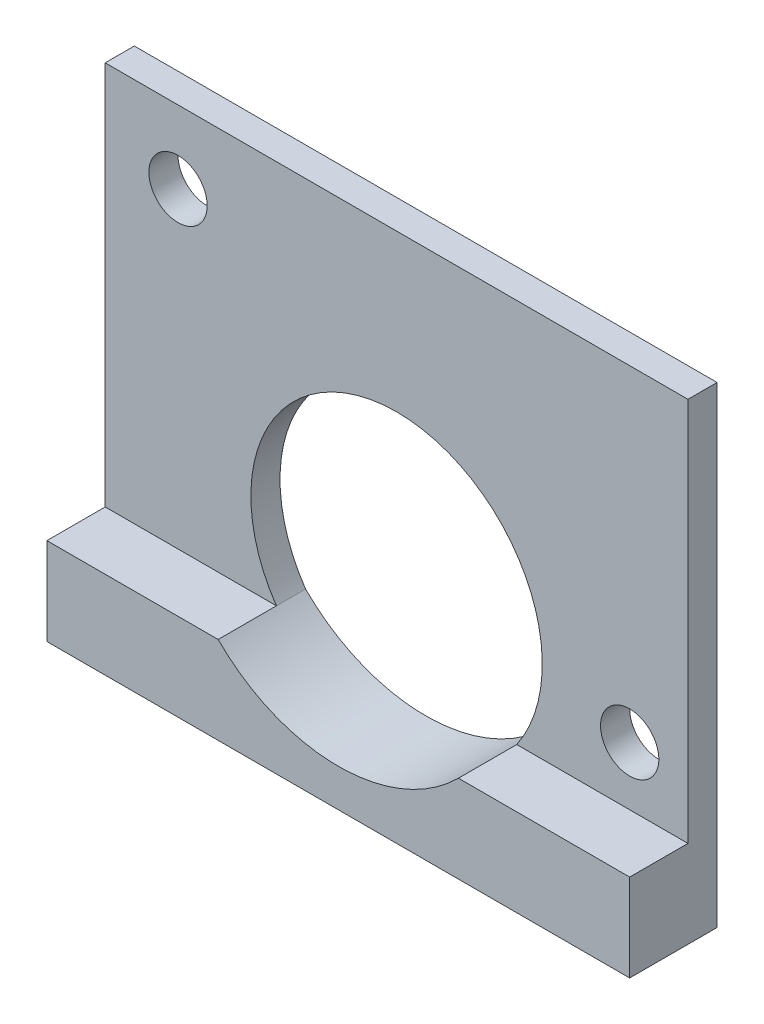
from build123d import *

# Parameters (mm, degrees)
CROQUIS1_R              = 1.628014373
SALIENTE_EXTRUIR1_DEPTH = 4
SALIENTE_EXTRUIR2_DEPTH = 9
CROQUIS3_R              = 1.5
CORTAR_EXTRUIR1_DEPTH   = 4
SALIENTE_EXTRUIR3_DEPTH = 7
CORTAR_EXTRUIR2_DEPTH   = 4.8
CROQUIS10_R             = 1
CORTAR_EXTRUIR3_DEPTH   = 4
SALIENTE_EXTRUIR4_START = 1
CROQUIS11_R             = 1
CROQUIS11_W             = 5.6
CROQUIS11_H             = 2.5
SALIENTE_EXTRUIR4_DEPTH = 1
CROQUIS12_W             = 27.503266124
CROQUIS12_H             = 20
CORTAR_EXTRUIR4_DEPTH   = 13
CROQUIS13_W             = 5.6
CROQUIS13_H             = 2.5
SALIENTE_EXTRUIR5_DEPTH = 1
SALIENTE_EXTRUIR6_DEPTH = 3
CROQUIS15_W             = 3
CROQUIS15_H             = 7
CORTAR_EXTRUIR5_DEPTH   = 3


with BuildPart() as part:
    # Croquis1 → Saliente-Extruir1 (new body)
    with BuildSketch(Plane.XY):
        with BuildLine():
            Line((-79.034482165, 42.285614206), (-79.034482165, 34.285614206))
            Line((-79.034482165, 34.285614206), (-85.534482165, 34.285614206))
            Line((-85.534482165, 34.285614206), (-85.534482165, 43.91362858))
            ThreePointArc((-85.534482165, 43.91362858), (-89.034482165, 47.41362858), (-92.534482165, 43.91362858))
            Line((-92.534482165, 43.91362858), (-92.534482165, 34.285614206))
            Line((-92.534482165, 34.285614206), (-99.034482165, 34.285614206))
            Line((-99.034482165, 34.285614206), (-99.034482165, 42.285614206))
            Line((-99.034482165, 42.285614206), (-99.034482165, 54.285614206))
            Line((-99.034482165, 54.285614206), (-79.034482165, 54.285614206))
            Line((-79.034482165, 54.285614206), (-79.034482165, 42.285614206))
        make_face()
        with Locations((-96.034482165, 38.285614206)):
            Circle(CROQUIS1_R, mode=Mode.SUBTRACT)
        with Locations((-82.034482165, 38.285614206)):
            Circle(CROQUIS1_R, mode=Mode.SUBTRACT)
    extrude(amount=SALIENTE_EXTRUIR1_DEPTH)

    # Croquis2 → Saliente-Extruir2 (add)
    with BuildSketch(Plane(origin=(0, 0, 0), x_dir=(-1, 0, 0), z_dir=(0, 0, -1))):
        with BuildLine():
            Line((79.034482165, 41.085614206), (83.629638531, 41.085614206))
            ThreePointArc((83.629638531, 41.085614206), (89.034482165, 50.01362858), (94.439325799, 41.085614206))
            Line((94.439325799, 41.085614206), (99.034482165, 41.085614206))
            Line((99.034482165, 41.085614206), (99.034482165, 54.285614206))
            Line((99.034482165, 54.285614206), (79.034482165, 54.285614206))
            Line((79.034482165, 54.285614206), (79.034482165, 41.085614206))
        make_face()
    extrude(amount=SALIENTE_EXTRUIR2_DEPTH)

    # Croquis3 → Cortar-Extruir1 (cut)
    with BuildSketch(Plane(origin=(0, 54.285614206, 0), x_dir=(1, 0, 0), z_dir=(0, 1, 0))):
        with Locations(Location((-90.034482165, 7, 0), (0, 0, 270))):
            Circle(CROQUIS3_R)
        with BuildLine():
            Line((-79.034482165, 8.118033989), (-79.034482165, 5.881966011))
            ThreePointArc((-79.034482165, 5.881966011), (-81.534482165, 7), (-79.034482165, 8.118033989))
        make_face()
    extrude(amount=-CORTAR_EXTRUIR1_DEPTH, mode=Mode.SUBTRACT)

    # Croquis4 → Saliente-Extruir3 (add)
    with BuildSketch(Plane(origin=(0, 54.285614206, 0), x_dir=(1, 0, 0), z_dir=(0, 1, 0))):
        with BuildLine():
            Line((-76.034482165, 1), (-76.034482165, 9))
            Line((-76.034482165, 9), (-79.034482165, 9))
            Line((-79.034482165, 9), (-79.034482165, 8.118033989))
            ThreePointArc((-79.034482165, 8.118033989), (-78.534482165, 7), (-79.034482165, 5.881966011))
            Line((-79.034482165, 5.881966011), (-79.034482165, -4))
            Line((-79.034482165, -4), (-76.034482165, 1))
        make_face()
    extrude(amount=-SALIENTE_EXTRUIR3_DEPTH)

    # Croquis5 → Cortar-Extruir2 (cut)
    with BuildSketch(Plane(origin=(0, 0, -9), x_dir=(-1, 0, 0), z_dir=(0, 0, -1))):
        Polygon((90.034482165, 50.285614206), (92.834482165, 50.285614206), (92.834482165, 52.785614206), (87.234482165, 52.785614206), (87.234482165, 50.285614206), align=None)
        Polygon((80.034482165, 50.285614206), (82.834482165, 50.285614206), (82.834482165, 52.785614206), (77.234482165, 52.785614206), (77.234482165, 50.285614206), align=None)
    extrude(amount=-CORTAR_EXTRUIR2_DEPTH, mode=Mode.SUBTRACT)

    # Croquis10 → Cortar-Extruir3 (cut)
    with BuildSketch(Plane(origin=(0, 0, -9), x_dir=(-1, 0, 0), z_dir=(0, 0, -1))):
        with Locations((96.534482165, 51.785614206)):
            Circle(CROQUIS10_R)
        with Locations((81.034482165, 43.085614206)):
            Circle(CROQUIS10_R)
    extrude(amount=-CORTAR_EXTRUIR3_DEPTH, mode=Mode.SUBTRACT)

    # Croquis11 → Saliente-Extruir4 (add)
    with BuildSketch(Plane(origin=(0, 0, -9), x_dir=(-1, 0, 0), z_dir=(0, 0, -1)).offset(SALIENTE_EXTRUIR4_START)):
        with BuildLine():
            Line((94.439325799, 41.085614206), (99.034482165, 41.085614206))
            Line((99.034482165, 41.085614206), (99.034482165, 54.285614206))
            Line((99.034482165, 54.285614206), (76.034482165, 54.285614206))
            Line((76.034482165, 54.285614206), (76.034482165, 47.285614206))
            Line((76.034482165, 47.285614206), (79.034482165, 47.285614206))
            Line((79.034482165, 47.285614206), (79.034482165, 41.085614206))
            Line((79.034482165, 41.085614206), (83.629638531, 41.085614206))
            Line((83.629638531, 41.085614206), (84.911093424, 41.085614206))
            ThreePointArc((84.911093424, 41.085614206), (89.034482165, 48.91362858), (93.157870905, 41.085614206))
            Line((93.157870905, 41.085614206), (94.439325799, 41.085614206))
        make_face()
        with Locations((96.534482165, 51.785614206)):
            Circle(CROQUIS11_R, mode=Mode.SUBTRACT)
        with Locations((81.034482165, 43.085614206)):
            Circle(CROQUIS11_R, mode=Mode.SUBTRACT)
        with Locations((90.034482165, 51.535614206)):
            Rectangle(CROQUIS11_W, CROQUIS11_H, mode=Mode.SUBTRACT)
        with Locations((80.034482165, 51.535614206)):
            Rectangle(CROQUIS11_W, CROQUIS11_H, mode=Mode.SUBTRACT)
    extrude(amount=-SALIENTE_EXTRUIR4_DEPTH)

    # Croquis12 → Cortar-Extruir4 (cut)
    with BuildSketch(Plane.XY.offset(4)):
        with Locations((-85.282849103, 44.285614206)):
            Rectangle(CROQUIS12_W, CROQUIS12_H)
    extrude(amount=-CORTAR_EXTRUIR4_DEPTH, mode=Mode.SUBTRACT)

    # Croquis13 → Saliente-Extruir5 (add)
    with BuildSketch(Plane(origin=(0, 0, -10), x_dir=(-1, 0, 0), z_dir=(0, 0, -1))):
        with Locations((90.034482165, 51.535614206)):
            Rectangle(CROQUIS13_W, CROQUIS13_H)
        with Locations((80.034482165, 51.535614206)):
            Rectangle(CROQUIS13_W, CROQUIS13_H)
    extrude(amount=-SALIENTE_EXTRUIR5_DEPTH)

    # Croquis14 → Saliente-Extruir6 (add)
    with BuildSketch(Plane(origin=(0, 0, -10), x_dir=(-1, 0, 0), z_dir=(0, 0, -1))):
        with BuildLine():
            Line((99.034482165, 41.085614206), (99.034482165, 38.085614206))
            Line((99.034482165, 38.085614206), (79.034482165, 38.085614206))
            Line((79.034482165, 38.085614206), (79.034482165, 41.085614206))
            Line((79.034482165, 41.085614206), (84.911093424, 41.085614206))
            ThreePointArc((84.911093424, 41.085614206), (89.034482165, 39.377650667), (93.157870905, 41.085614206))
            Line((93.157870905, 41.085614206), (99.034482165, 41.085614206))
        make_face()
    extrude(amount=-SALIENTE_EXTRUIR6_DEPTH)

    # Croquis15 → Cortar-Extruir5 (cut)
    with BuildSketch(Plane(origin=(0, 0, -10), x_dir=(-1, 0, 0), z_dir=(0, 0, -1))):
        with Locations((77.534482165, 50.785614206)):
            Rectangle(CROQUIS15_W, CROQUIS15_H)
    extrude(amount=-CORTAR_EXTRUIR5_DEPTH, mode=Mode.SUBTRACT)


solid = part.part
